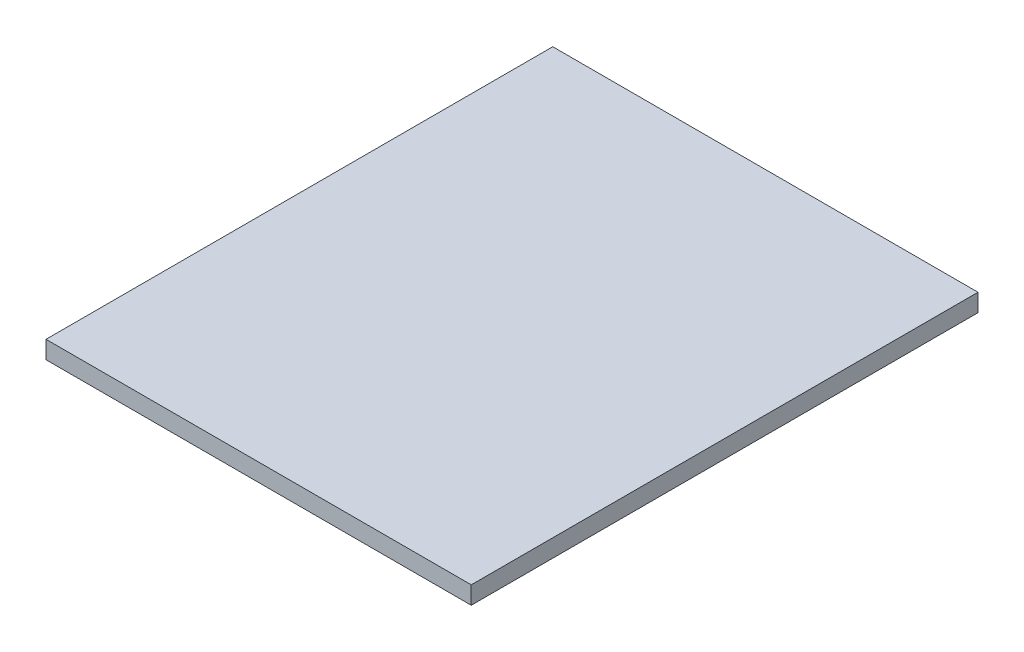
from build123d import *

# Parameters (mm, degrees)
SKETCH1_W           = 76.2
SKETCH1_H           = 90.805
BOSS_EXTRUDE1_DEPTH = 3.175


with BuildPart() as part:
    # Sketch1 → Boss-Extrude1 (new body)
    with BuildSketch(Plane(origin=(0, 0, 0), x_dir=(1, 0, 0), z_dir=(0, 1, 0))):
        Rectangle(SKETCH1_W, SKETCH1_H)
    extrude(amount=BOSS_EXTRUDE1_DEPTH)


solid = part.part
